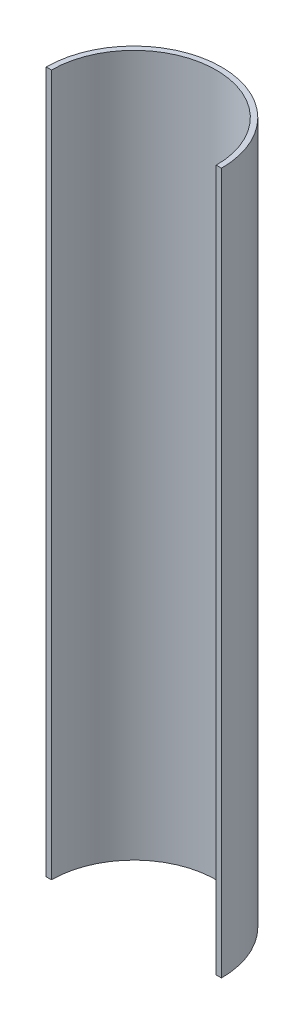
from build123d import *

# Parameters (mm, degrees)
BOSS_EXTRU_1_DEPTH = 400


with BuildPart() as part:
    # Esquisse1 → Boss.-Extru.1 (new body)
    with BuildSketch(Plane(origin=(0, 0, 0), x_dir=(1, 0, 0), z_dir=(0, 1, 0))):
        with BuildLine():
            ThreePointArc((1.5, 0), (48.5, 47), (95.5, 0))
            Line((95.5, 0), (98.5, 0))
            ThreePointArc((98.5, 0), (48.5, 50), (-1.5, 0))
            Line((-1.5, 0), (1.5, 0))
        make_face()
    extrude(amount=BOSS_EXTRU_1_DEPTH)


solid = part.part
